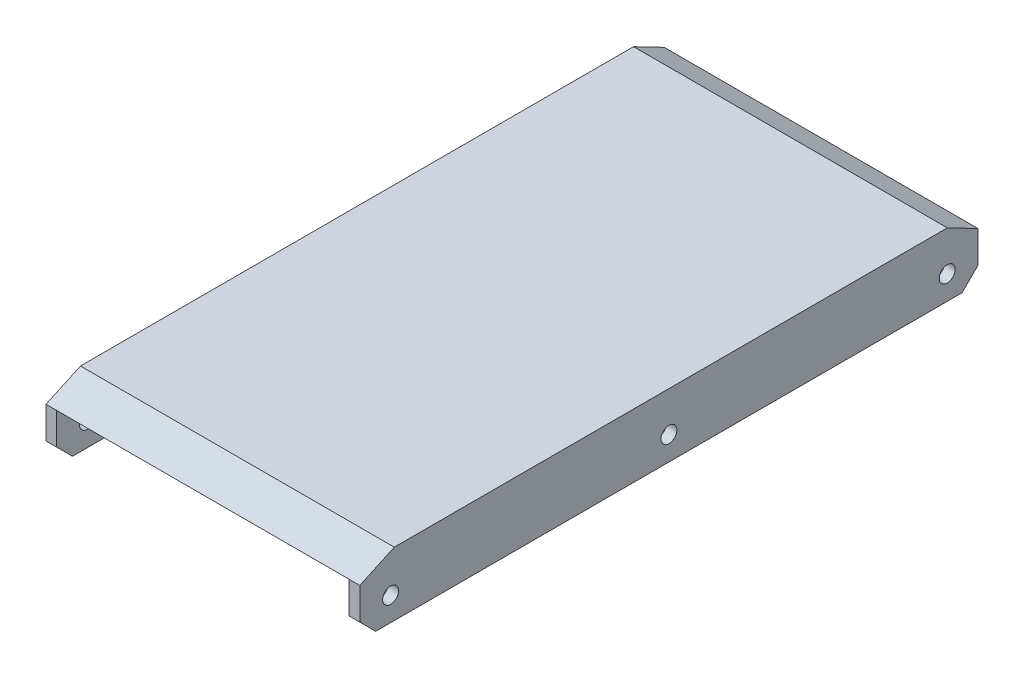
from build123d import *

# Parameters (mm, degrees)
SKETCH1_W           = 116.62
SKETCH1_H           = 9
BOSS_EXTRUDE1_DEPTH = 2
SKETCH6_R           = 1.5
CUT_EXTRUDE1_DEPTH  = 60.034363721
CHAMFER4_SIZE       = 3
SKETCH9_R           = 1.5
BOSS_EXTRUDE4_DEPTH = 2
BOSS_EXTRUDE5_START = -2
BOSS_EXTRUDE5_DEPTH = 59.2


with BuildPart() as part:
    # Sketch1 → Boss-Extrude1 (new body)
    with BuildSketch(Plane(origin=(0, 0, 0), x_dir=(0, 0, -1), z_dir=(1, 0, 0))):
        with Locations((0, -4.5)):
            Rectangle(SKETCH1_W, SKETCH1_H)
    extrude(amount=BOSS_EXTRUDE1_DEPTH)

    # Sketch6 → Cut-Extrude1 (cut, through all)
    with BuildSketch(Plane.ZY):
        with Locations((0, -4.5)):
            Circle(SKETCH6_R)
        with Locations((52.5, -4.5)):
            Circle(SKETCH6_R)
        with Locations((-52.5, -4.5)):
            Circle(SKETCH6_R)
    extrude(amount=-CUT_EXTRUDE1_DEPTH, mode=Mode.SUBTRACT)

    # Chamfer4
    chamfer4_edges = [part.edges().sort_by_distance(p)[0] for p in [
        (1, -9, -58.31),
        (1, -9, 58.31),
    ]]
    chamfer(chamfer4_edges, length=CHAMFER4_SIZE)



with BuildPart() as body_2:
    # Sketch9 → Boss-Extrude4 (new body)
    with BuildSketch(Plane(origin=(57.2, 0, 0), x_dir=(0, 0, -1), z_dir=(1, 0, 0))):
        Polygon((-58.31, 0), (-58.31, -6), (-55.31, -9), (55.31, -9), (58.31, -6), (58.31, 0), align=None)
        with Locations(Location((0, -4.5, 0), (0, 0, 180))):
            Circle(SKETCH9_R, mode=Mode.SUBTRACT)
        with Locations(Location((-52.5, -4.5, 0), (0, 0, 180))):
            Circle(SKETCH9_R, mode=Mode.SUBTRACT)
        with Locations(Location((52.5, -4.5, 0), (0, 0, 180))):
            Circle(SKETCH9_R, mode=Mode.SUBTRACT)
    extrude(amount=BOSS_EXTRUDE4_DEPTH)


with BuildPart() as part_1:
    add(part.part)

    add(body_2.part)  # Boss-Extrude5 merges body 2
    # Sketch4 → Boss-Extrude5 (add)
    with BuildSketch(Plane(origin=(2, 0, 0), x_dir=(0, 0, -1), z_dir=(1, 0, 0)).offset(BOSS_EXTRUDE5_START)):
        Polygon((-58.31, 0), (-51.811665078, 3), (52.525651767, 3), (58.31, 0), align=None)
    extrude(amount=BOSS_EXTRUDE5_DEPTH)


solid = part_1.part
